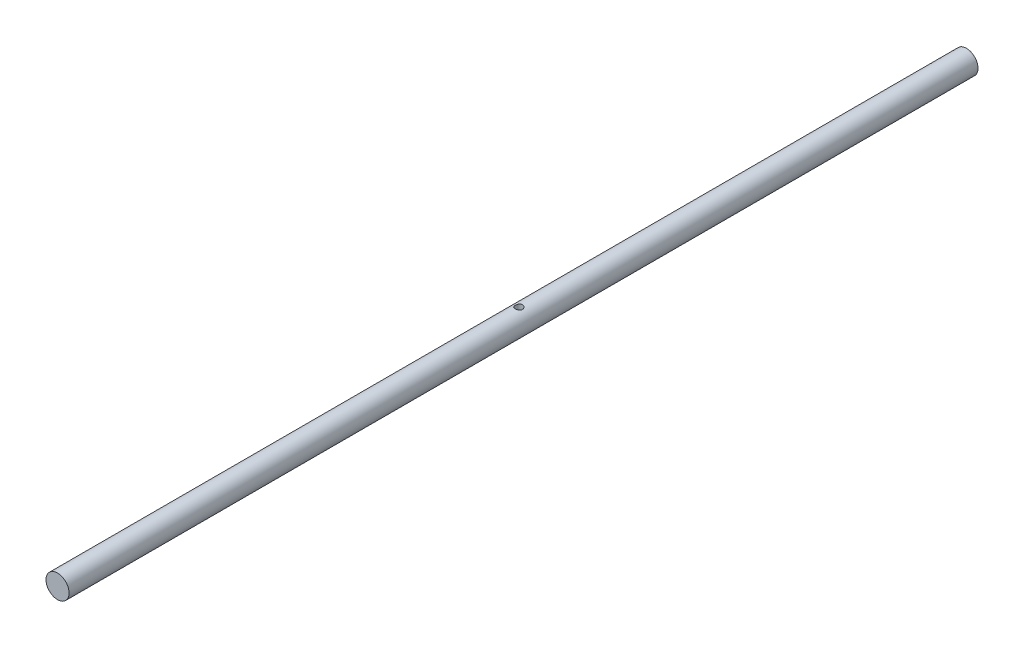
from build123d import *

# Parameters (mm, degrees)
SKETCH1_R               = 12.7
BOSS_EXTRUDE1_DEPTH     = 1000
CUT_EXTRUDE1_DEPTH      = 1001.161276995
CUT_EXTRUDE1_DEPTH_BACK = 1001.161276995
SKETCH2_R               = 3.96875


with BuildPart() as part:
    # Sketch1 → Boss-Extrude1 (new body)
    with BuildSketch(Plane.XY):
        Circle(SKETCH1_R)
    extrude(amount=BOSS_EXTRUDE1_DEPTH)

    # Sketch2 → Cut-Extrude1 (cut, two sides: drawn at the far end of the back side and taken through both)
    with BuildSketch(Plane(origin=(0, 0, 0), x_dir=(1, 0, 0), z_dir=(0, 1, 0)).offset(-CUT_EXTRUDE1_DEPTH_BACK)):
        with Locations(Location((0, -492.5, 0), (0, 0, 270))):
            Circle(SKETCH2_R)
    extrude(amount=CUT_EXTRUDE1_DEPTH + CUT_EXTRUDE1_DEPTH_BACK, mode=Mode.SUBTRACT)


solid = part.part
